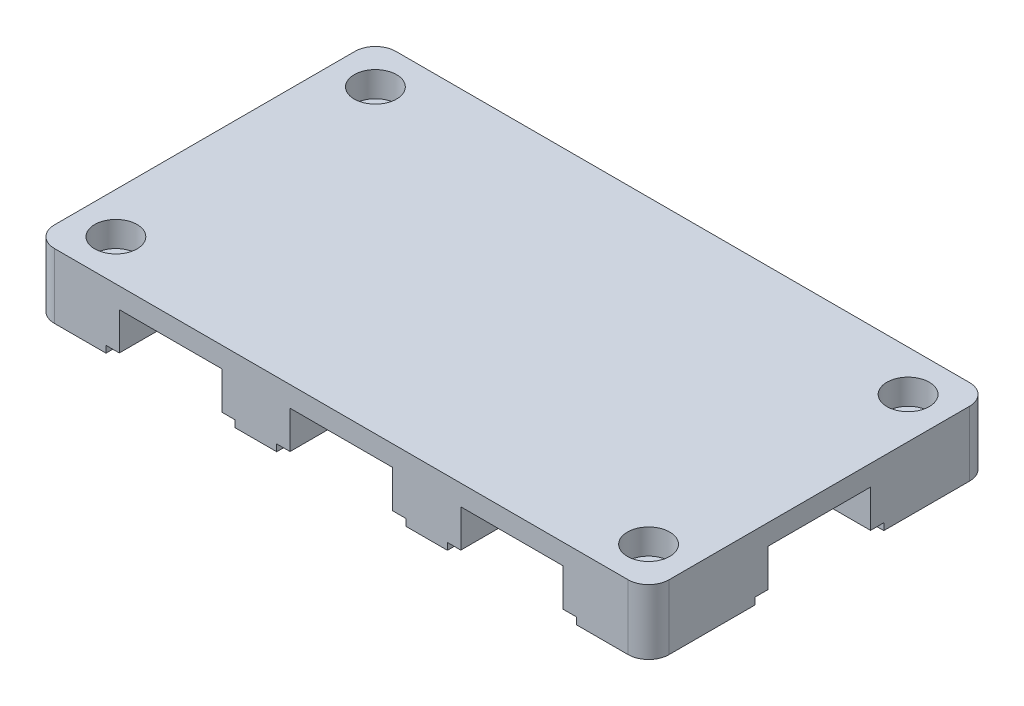
from build123d import *

# Parameters (mm, degrees)
SKETCH_1_R          = 1.6
EXTRUDE_1_DEPTH     = 8.5
CUT_EXTRUDE_START   = -8.5
SKETCH_2_W          = 15
SKETCH_2_H          = 10.3
SKETCH_2_W_2        = 10.3
SKETCH_2_H_2        = 15
CUT_EXTRUDE_1_DEPTH = 6.5
SKETCH_3_W          = 9.2
SKETCH_3_H          = 7.6
CUT_EXTRUDE_2_DEPTH = 3.4
SKETCH_4_W          = 8
SKETCH_4_H          = 6
CUT_EXTRUDE_3_DEPTH = 2.6
SKETCH_7_W          = 9.6
SKETCH_7_H          = 11.1
CUT_EXTRUDE_4_DEPTH = 1
SKETCH_8_W          = 12.3
SKETCH_8_H          = 5.7
CUT_EXTRUDE_5_DEPTH = 3.4
SKETCH_8_3_W        = 14.7
SKETCH_8_3_H        = 12.8
CUT_EXTRUDE_6_DEPTH = 2
SKETCH_8_4_W        = 11.8
SKETCH_8_4_H        = 18.9
SKETCH_8_4_W_2      = 4.2
SKETCH_8_4_H_2      = 2
SKETCH_8_4_W_3      = 8.3
SKETCH_8_4_H_3      = 1.4
SKETCH_8_4_W_4      = 1.2
SKETCH_8_4_W_5      = 3.4
SKETCH_8_4_W_6      = 18.9
SKETCH_8_4_H_4      = 11.8
CUT_EXTRUDE_7_DEPTH = 1
SKETCH_9_R          = 3.1
CUT_EXTRUDE_8_DEPTH = 2.7
SKETCH_10_R         = 3.1
EXTRUDE_2_DEPTH     = 1


with BuildPart() as part:
    # 草图1 → 凸台-拉伸1 (new body)
    with BuildSketch(Plane(origin=(0, 0, 0), x_dir=(1, 0, 0), z_dir=(0, 1, 0))):
        with BuildLine():
            Line((-42, -25), (42, -25))
            ThreePointArc((42, -25), (44.121320344, -24.121320344), (45, -22))
            Line((45, -22), (45, 22))
            ThreePointArc((45, 22), (44.121320344, 24.121320344), (42, 25))
            Line((42, 25), (-42, 25))
            ThreePointArc((-42, 25), (-44.121320344, 24.121320344), (-45, 22))
            Line((-45, 22), (-45, -22))
            ThreePointArc((-45, -22), (-44.121320344, -24.121320344), (-42, -25))
        make_face()
        with Locations(Location((-39, 19, 0), (0, 0, 270))):
            Circle(SKETCH_1_R, mode=Mode.SUBTRACT)
        with Locations(Location((39, 19, 0), (0, 0, 270))):
            Circle(SKETCH_1_R, mode=Mode.SUBTRACT)
        with Locations(Location((-39, -19, 0), (0, 0, 270))):
            Circle(SKETCH_1_R, mode=Mode.SUBTRACT)
        with Locations(Location((39, -19, 0), (0, 0, 270))):
            Circle(SKETCH_1_R, mode=Mode.SUBTRACT)
    extrude(amount=EXTRUDE_1_DEPTH)

    # 草图2 → 切除-拉伸1 (cut)
    with BuildSketch(Plane(origin=(0, 8.5, 0), x_dir=(1, 0, 0), z_dir=(0, 1, 0)).offset(CUT_EXTRUDE_START)):
        with Locations((0, -19.85)):
            Rectangle(SKETCH_2_W, SKETCH_2_H)
        with Locations((-25, -19.85)):
            Rectangle(SKETCH_2_W, SKETCH_2_H)
        with Locations((25, -19.85)):
            Rectangle(SKETCH_2_W, SKETCH_2_H)
        with Locations((-39.85, 0)):
            Rectangle(SKETCH_2_W_2, SKETCH_2_H_2)
        with Locations((39.85, 0)):
            Rectangle(SKETCH_2_W_2, SKETCH_2_H_2)
    extrude(amount=CUT_EXTRUDE_1_DEPTH, mode=Mode.SUBTRACT)

    # 草图3 → 切除-拉伸2 (cut)
    with BuildSketch(Plane(origin=(0, 8.5, 0), x_dir=(1, 0, 0), z_dir=(0, 1, 0)).offset(CUT_EXTRUDE_START)):
        with Locations((-9.142, 21.2)):
            Rectangle(SKETCH_3_W, SKETCH_3_H)
    extrude(amount=CUT_EXTRUDE_2_DEPTH, mode=Mode.SUBTRACT)

    # 草图4 → 切除-拉伸3 (cut)
    with BuildSketch(Plane(origin=(0, 8.5, 0), x_dir=(1, 0, 0), z_dir=(0, 1, 0)).offset(CUT_EXTRUDE_START)):
        with Locations((6.466, 22)):
            Rectangle(SKETCH_4_W, SKETCH_4_H)
    extrude(amount=CUT_EXTRUDE_3_DEPTH, mode=Mode.SUBTRACT)

    # 草图7 → 切除-拉伸4 (cut)
    with BuildSketch(Plane(origin=(0, 8.5, 0), x_dir=(1, 0, 0), z_dir=(0, 1, 0)).offset(CUT_EXTRUDE_START)):
        with Locations((-25, 27.45)):
            Rectangle(SKETCH_7_W, SKETCH_7_H)
    extrude(amount=CUT_EXTRUDE_4_DEPTH, mode=Mode.SUBTRACT)

    # 草图8 → 切除-拉伸5 (cut)
    with BuildSketch(Plane.XZ):
        with Locations((25, -22.15)):
            Rectangle(SKETCH_8_W, SKETCH_8_H)
    extrude(amount=-CUT_EXTRUDE_5_DEPTH, mode=Mode.SUBTRACT)

    # 草图8<3> → 切除-拉伸6 (cut)
    with BuildSketch(Plane.XZ):
        with Locations((27.35, 0)):
            Rectangle(SKETCH_8_3_W, SKETCH_8_3_H)
    extrude(amount=-CUT_EXTRUDE_6_DEPTH, mode=Mode.SUBTRACT)

    # 草图8<4> → 切除-拉伸7 (cut)
    with BuildSketch(Plane.XZ):
        with Locations((-39.1, 0)):
            Rectangle(SKETCH_8_4_W, SKETCH_8_4_H)
        with Locations((-29.4, 0)):
            Rectangle(SKETCH_8_4_W_2, SKETCH_8_4_H_2)
        with Locations((-25, -21.2)):
            Rectangle(SKETCH_8_4_W_3, SKETCH_8_4_H_3)
        with Locations((-17.06, -18.4)):
            Rectangle(SKETCH_8_4_W_4, SKETCH_8_4_H_2)
        with Locations((-1.312, -18.4)):
            Rectangle(SKETCH_8_4_W_4, SKETCH_8_4_H_2)
        with Locations((6.466, -18.3)):
            Rectangle(SKETCH_8_4_W_5, SKETCH_8_4_H_3)
        with Locations((39.1, 0)):
            Rectangle(SKETCH_8_4_W, SKETCH_8_4_H)
        with Locations((-25, 19.1)):
            Rectangle(SKETCH_8_4_W_6, SKETCH_8_4_H_4)
        with Locations((0, 19.1)):
            Rectangle(SKETCH_8_4_W_6, SKETCH_8_4_H_4)
        with Locations((25, 19.1)):
            Rectangle(SKETCH_8_4_W_6, SKETCH_8_4_H_4)
    extrude(amount=-CUT_EXTRUDE_7_DEPTH, mode=Mode.SUBTRACT)

    # 草图9 → 切除-拉伸8 (cut)
    with BuildSketch(Plane(origin=(0, 8.5, 0), x_dir=(1, 0, 0), z_dir=(0, 1, 0))):
        with Locations(Location((-39, 19, 0), (0, 0, 270))):
            Circle(SKETCH_9_R)
        with Locations(Location((-39, -19, 0), (0, 0, 270))):
            Circle(SKETCH_9_R)
        with Locations(Location((39, 19, 0), (0, 0, 270))):
            Circle(SKETCH_9_R)
        with Locations(Location((39, -19, 0), (0, 0, 270))):
            Circle(SKETCH_9_R)
    extrude(amount=-CUT_EXTRUDE_8_DEPTH, mode=Mode.SUBTRACT)

    # 草图10 → 凸台-拉伸2 (add)
    with BuildSketch(Plane(origin=(0, 8.5, 0), x_dir=(1, 0, 0), z_dir=(0, 1, 0))):
        with BuildLine():
            Line((-42, -25), (42, -25))
            ThreePointArc((42, -25), (44.121320344, -24.121320344), (45, -22))
            Line((45, -22), (45, 22))
            ThreePointArc((45, 22), (44.121320344, 24.121320344), (42, 25))
            Line((42, 25), (-42, 25))
            ThreePointArc((-42, 25), (-44.121320344, 24.121320344), (-45, 22))
            Line((-45, 22), (-45, -22))
            ThreePointArc((-45, -22), (-44.121320344, -24.121320344), (-42, -25))
        make_face()
        with Locations(Location((39, -19, 0), (0, 0, 270))):
            Circle(SKETCH_10_R, mode=Mode.SUBTRACT)
        with Locations(Location((39, 19, 0), (0, 0, 270))):
            Circle(SKETCH_10_R, mode=Mode.SUBTRACT)
        with Locations(Location((-39, -19, 0), (0, 0, 270))):
            Circle(SKETCH_10_R, mode=Mode.SUBTRACT)
        with Locations(Location((-39, 19, 0), (0, 0, 270))):
            Circle(SKETCH_10_R, mode=Mode.SUBTRACT)
    extrude(amount=EXTRUDE_2_DEPTH)


solid = part.part
